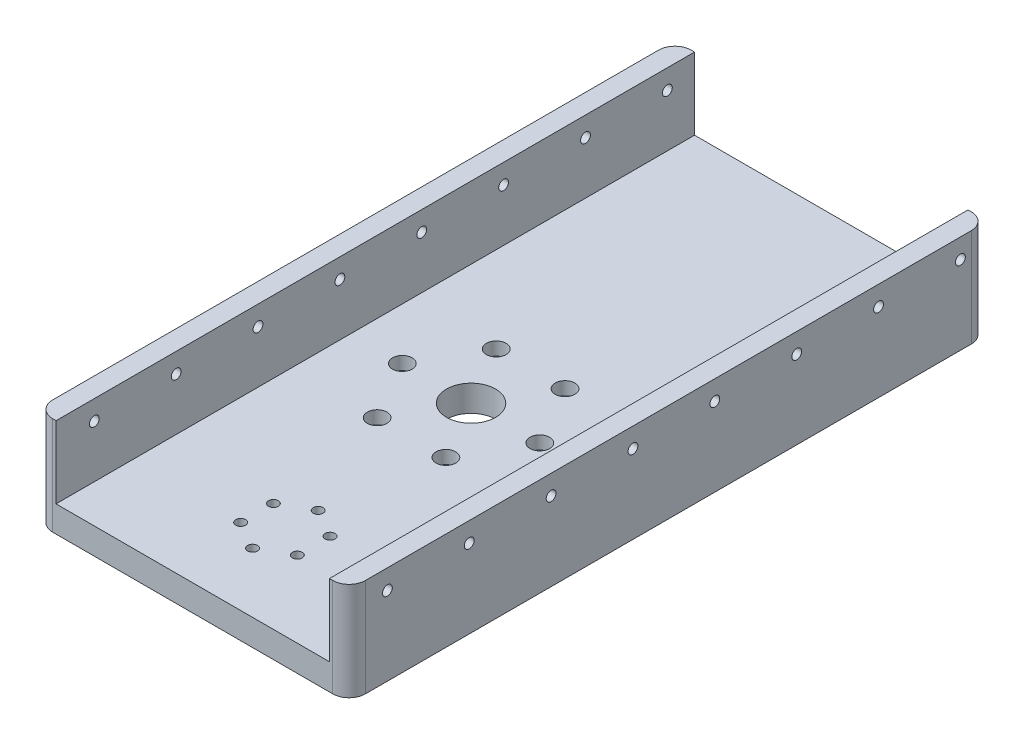
from build123d import *

# Parameters (mm, degrees)
SKETCH1_W               = 89.5
SKETCH1_H               = 125
BOSS_EXTRUDE1_DEPTH     = 8
SKETCH2_R               = 7.5
SKETCH2_R_2             = 3
CUT_EXTRUDE1_DEPTH      = 4
SKETCH3_R               = 7.5
CUT_EXTRUDE2_DEPTH      = 154.789629039
SKETCH4_W               = 125
SKETCH4_H               = 22
SKETCH4_R               = 1.5
BOSS_EXTRUDE2_DEPTH     = 6
SKETCH5_R               = 1.5
CUT_EXTRUDE3_DEPTH      = 156.303734662
SKETCH8_W               = 125
SKETCH8_H               = 30
BOSS_EXTRUDE3_DEPTH     = 6
BOSS_EXTRUDE4_DEPTH     = 70
CUT_EXTRUDE5_DEPTH      = 217.645447679
CUT_EXTRUDE5_DEPTH_BACK = 217.645447679
SKETCH9_R               = 1.5
FILLET2_R               = 5
SKETCH12_R              = 1.5
CUT_EXTRUDE6_DEPTH      = 216.683216779


with BuildPart() as part:
    # Sketch1 → Boss-Extrude1 (new body)
    with BuildSketch(Plane(origin=(0, 0, 0), x_dir=(1, 0, 0), z_dir=(0, 1, 0))):
        with Locations((44.75, 62.5)):
            Rectangle(SKETCH1_W, SKETCH1_H)
    extrude(amount=BOSS_EXTRUDE1_DEPTH)

    # Sketch2 → Cut-Extrude1 (cut)
    with BuildSketch(Plane(origin=(0, 8, 0), x_dir=(-1, 0, 0), z_dir=(0, 1, 0))):
        with Locations(Location((-36.75, -90, 0), (0, 0, 90))):
            Circle(SKETCH2_R)
        with Locations(Location((-57.75, -90, 0), (0, 0, 90))):
            Circle(SKETCH2_R_2)
        with Locations(Location((-47.25, -71.813466521, 0), (0, 0, 90))):
            Circle(SKETCH2_R_2)
        with Locations(Location((-26.25, -71.813466521, 0), (0, 0, 90))):
            Circle(SKETCH2_R_2)
        with Locations(Location((-15.75, -90, 0), (0, 0, 90))):
            Circle(SKETCH2_R_2)
        with Locations(Location((-26.25, -108.186533479, 0), (0, 0, 90))):
            Circle(SKETCH2_R_2)
        with Locations(Location((-47.25, -108.186533479, 0), (0, 0, 90))):
            Circle(SKETCH2_R_2)
    extrude(amount=-CUT_EXTRUDE1_DEPTH, mode=Mode.SUBTRACT)

    # Sketch3 → Cut-Extrude2 (cut, through all)
    with BuildSketch(Plane(origin=(0, 4, 0), x_dir=(1, 0, 0), z_dir=(0, 1, 0))):
        with Locations(Location((36.75, 90, 0), (0, 0, 270))):
            Circle(SKETCH3_R)
    extrude(amount=-CUT_EXTRUDE2_DEPTH, mode=Mode.SUBTRACT)

    # Sketch4 → Boss-Extrude2 (add)
    with BuildSketch(Plane(origin=(89.5, 0, 0), x_dir=(0, 0, -1), z_dir=(1, 0, 0))):
        with Locations((62.5, 19)):
            Rectangle(SKETCH4_W, SKETCH4_H)
        with Locations((11.692170277, 24)):
            Circle(SKETCH4_R, mode=Mode.SUBTRACT)
        with Locations((36.692170277, 24)):
            Circle(SKETCH4_R, mode=Mode.SUBTRACT)
        with Locations((61.692170277, 24)):
            Circle(SKETCH4_R, mode=Mode.SUBTRACT)
        with Locations((86.692170277, 24)):
            Circle(SKETCH4_R, mode=Mode.SUBTRACT)
        with Locations((111.692170277, 24)):
            Circle(SKETCH4_R, mode=Mode.SUBTRACT)
    extrude(amount=-BOSS_EXTRUDE2_DEPTH)

    # Sketch5 → Cut-Extrude3 (cut, through all)
    with BuildSketch(Plane(origin=(0, 8, 0), x_dir=(-1, 0, 0), z_dir=(0, 1, 0))):
        with Locations(Location((-57.75, -90, 0), (0, 0, 90))):
            Circle(SKETCH5_R)
        with Locations(Location((-47.25, -71.813466521, 0), (0, 0, 90))):
            Circle(SKETCH5_R)
        with Locations(Location((-26.25, -71.813466521, 0), (0, 0, 90))):
            Circle(SKETCH5_R)
        with Locations(Location((-15.75, -90, 0), (0, 0, 90))):
            Circle(SKETCH5_R)
        with Locations(Location((-26.25, -108.186533479, 0), (0, 0, 90))):
            Circle(SKETCH5_R)
        with Locations(Location((-47.25, -108.186533479, 0), (0, 0, 90))):
            Circle(SKETCH5_R)
    extrude(amount=-CUT_EXTRUDE3_DEPTH, mode=Mode.SUBTRACT)

    # Sketch8 → Boss-Extrude3 (add)
    with BuildSketch(Plane.ZY):
        with Locations((-62.5, 15)):
            Rectangle(SKETCH8_W, SKETCH8_H)
    extrude(amount=BOSS_EXTRUDE3_DEPTH)

    # Sketch11 → Boss-Extrude4 (add)
    with BuildSketch(Plane(origin=(0, 0, -125), x_dir=(-1, 0, 0), z_dir=(0, 0, -1))):
        Polygon((6, 30), (0, 30), (0, 8), (-83.5, 8), (-83.5, 30), (-89.5, 30), (-89.5, 0), (6, 0), align=None)
    extrude(amount=BOSS_EXTRUDE4_DEPTH)

    # Sketch9 → Cut-Extrude5 (cut, two sides: drawn at the far end of the back side and taken through both)
    with BuildSketch(Plane(origin=(0, 0, 0), x_dir=(0, 0, -1), z_dir=(1, 0, 0)).offset(-CUT_EXTRUDE5_DEPTH_BACK)):
        with Locations((11.692170277, 24)):
            Circle(SKETCH9_R)
        with Locations((36.692170277, 24)):
            Circle(SKETCH9_R)
        with Locations((61.692170277, 24)):
            Circle(SKETCH9_R)
        with Locations((86.692170277, 24)):
            Circle(SKETCH9_R)
        with Locations((111.692170277, 24)):
            Circle(SKETCH9_R)
        with Locations(Location((136.692170277, 24, 0), (0, 0, 180))):
            Circle(SKETCH9_R)
        with Locations(Location((161.692170277, 24, 0), (0, 0, 180))):
            Circle(SKETCH9_R)
        with Locations(Location((186.692170277, 24, 0), (0, 0, 180))):
            Circle(SKETCH9_R)
    extrude(amount=CUT_EXTRUDE5_DEPTH + CUT_EXTRUDE5_DEPTH_BACK, mode=Mode.SUBTRACT)

    # Fillet2
    fillet2_edges = [part.edges().sort_by_distance(p)[0] for p in [
        (-6, 15, 0),
        (-6, 15, -195),
        (89.5, 15, -195),
        (89.5, 15, 0),
    ]]
    fillet(fillet2_edges, radius=FILLET2_R)

    # Sketch12 → Cut-Extrude6 (cut, through all)
    with BuildSketch(Plane(origin=(0, 8, 0), x_dir=(1, 0, 0), z_dir=(0, 1, 0))):
        with Locations(Location((41.75, 18.29, 0), (0, 0, 270))):
            Circle(SKETCH12_R)
        with Locations(Location((33.089745962, 23.29, 0), (0, 0, 270))):
            Circle(SKETCH12_R)
        with Locations(Location((33.089745962, 33.29, 0), (0, 0, 270))):
            Circle(SKETCH12_R)
        with Locations(Location((41.75, 38.29, 0), (0, 0, 270))):
            Circle(SKETCH12_R)
        with Locations(Location((50.410254038, 33.29, 0), (0, 0, 270))):
            Circle(SKETCH12_R)
        with Locations(Location((50.410254038, 23.29, 0), (0, 0, 270))):
            Circle(SKETCH12_R)
    extrude(amount=-CUT_EXTRUDE6_DEPTH, mode=Mode.SUBTRACT)


solid = part.part
